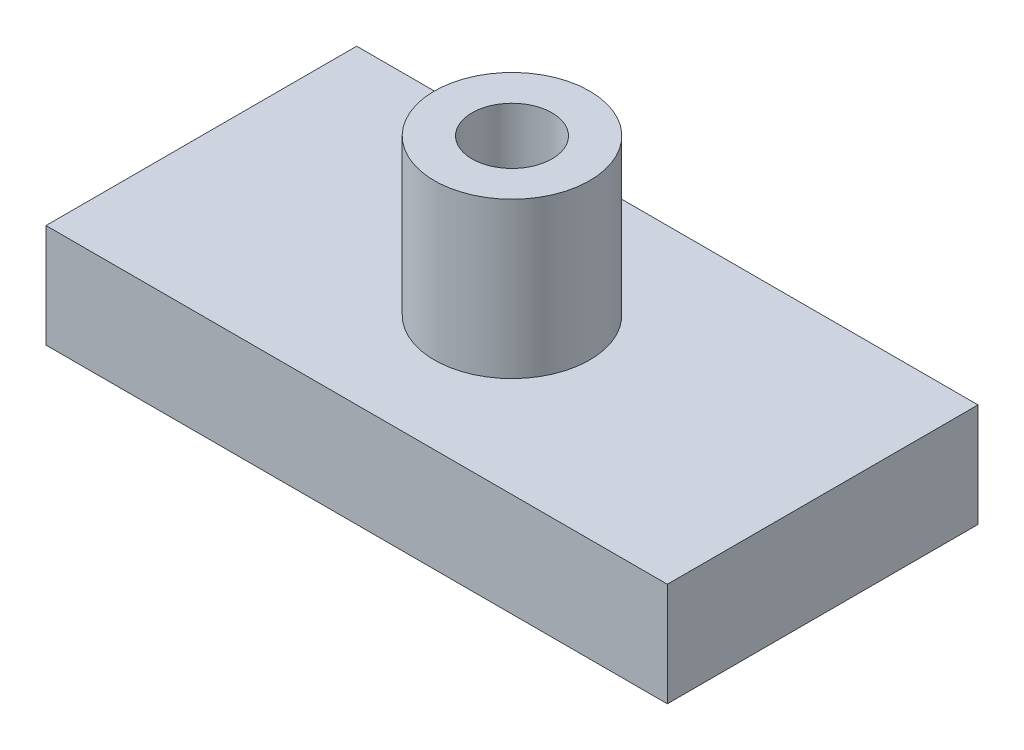
from build123d import *

# Parameters (mm, degrees)
SKETCH1_W           = 38.1
SKETCH1_H           = 19.05
BOSS_EXTRUDE1_DEPTH = 6.35
SKETCH2_R           = 4.7625
BOSS_EXTRUDE2_DEPTH = 9.525
SKETCH3_R           = 2.4511
CUT_EXTRUDE1_DEPTH  = 46.459081876


with BuildPart() as part:
    # Sketch1 → Boss-Extrude1 (new body)
    with BuildSketch(Plane(origin=(0, 0, 0), x_dir=(1, 0, 0), z_dir=(0, 1, 0))):
        with Locations((19.05, 9.525)):
            Rectangle(SKETCH1_W, SKETCH1_H)
    extrude(amount=BOSS_EXTRUDE1_DEPTH)

    # Sketch2 → Boss-Extrude2 (add)
    with BuildSketch(Plane(origin=(0, 6.35, 0), x_dir=(1, 0, 0), z_dir=(0, 1, 0))):
        with Locations(Location((19.05, 9.525, 0), (0, 0, 90))):
            Circle(SKETCH2_R)
    extrude(amount=BOSS_EXTRUDE2_DEPTH)

    # Sketch3 → Cut-Extrude1 (cut, through all)
    with BuildSketch(Plane(origin=(0, 15.875, 0), x_dir=(1, 0, 0), z_dir=(0, 1, 0))):
        with Locations(Location((19.05, 9.525, 0), (0, 0, 270))):
            Circle(SKETCH3_R)
    extrude(amount=-CUT_EXTRUDE1_DEPTH, mode=Mode.SUBTRACT)


solid = part.part
